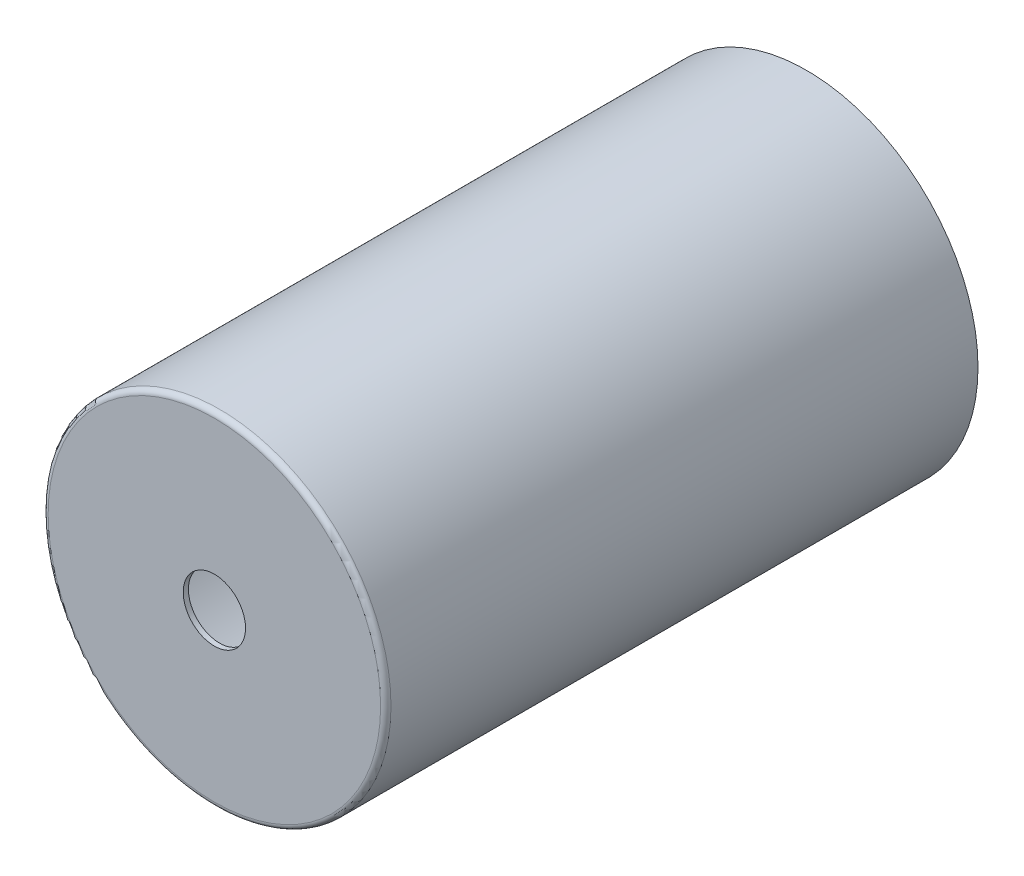
from build123d import *

# Parameters (mm, degrees)
SKETCH1_R           = 16.5
BOSS_EXTRUDE1_DEPTH = 57
SHELL1_T            = -0.5
SKETCH2_R           = 3
CUT_EXTRUDE1_DEPTH  = 62.591395503
FILLET1_R           = 0.5


with BuildPart() as part:
    # Sketch1 → Boss-Extrude1 (new body)
    with BuildSketch(Plane.XY):
        Circle(SKETCH1_R)
    extrude(amount=-BOSS_EXTRUDE1_DEPTH)

    # Shell1
    shell1_openings = [part.faces().sort_by_distance(p)[0] for p in [
        (0, 0, -57),
    ]]
    offset(amount=SHELL1_T, openings=shell1_openings, kind=Kind.INTERSECTION)

    # Sketch2 → Cut-Extrude1 (cut, through all)
    with BuildSketch(Plane.XY):
        Circle(SKETCH2_R)
    extrude(amount=-CUT_EXTRUDE1_DEPTH, mode=Mode.SUBTRACT)

    # Fillet1
    fillet1_edges = [part.edges().sort_by_distance(p)[0] for p in [
        (-16.5, 0, 0),
    ]]
    fillet(fillet1_edges, radius=FILLET1_R)


solid = part.part
